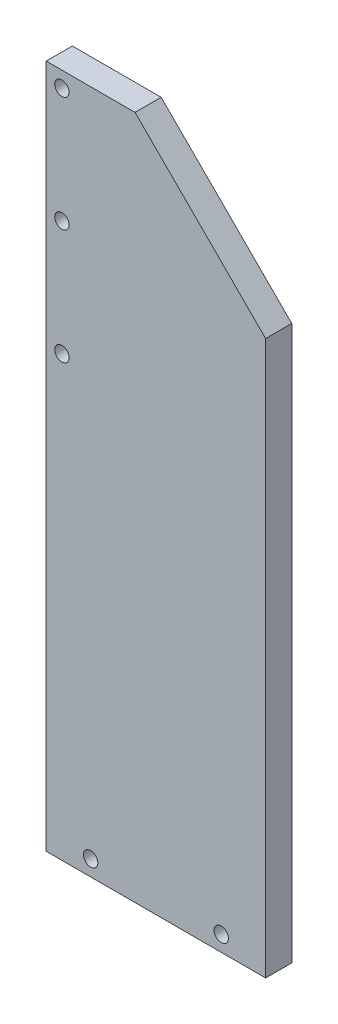
from build123d import *

# Parameters (mm, degrees)
SKETCH1_W                                       = 10
SKETCH1_H                                       = 262
BOSS_EXTRUDE1_DEPTH                             = 42
CBORE_FOR_M5_SOCKET_HEAD_CAP_SCREW1_D           = 5.5
CBORE_FOR_M5_SOCKET_HEAD_CAP_SCREW1_CBORE_D     = 10
CBORE_FOR_M5_SOCKET_HEAD_CAP_SCREW1_CBORE_DEPTH = 5
CBORE_FOR_M5_SOCKET_HEAD_CAP_SCREW2_D           = 5.5
CBORE_FOR_M5_SOCKET_HEAD_CAP_SCREW2_CBORE_D     = 10
CBORE_FOR_M5_SOCKET_HEAD_CAP_SCREW2_CBORE_DEPTH = 5
CHAMFER1_SIZE                                   = 50


with BuildPart() as part:
    # Sketch1 → Boss-Extrude1 (new, symmetric)
    with BuildSketch(Plane(origin=(0, 0, 0), x_dir=(0, 0, -1), z_dir=(1, 0, 0))):
        with Locations((-5, 131)):
            Rectangle(SKETCH1_W, SKETCH1_H)
    extrude(amount=BOSS_EXTRUDE1_DEPTH, both=True)

    # CBORE for M5 Socket Head Cap Screw1 (through all)
    with Locations(Plane(origin=(0, 0, 0), x_dir=(-1, 0, 0), z_dir=(0, 0, -1))):
        with Locations((36, 256), (36, 212), (36, 168)):
            CounterBoreHole(CBORE_FOR_M5_SOCKET_HEAD_CAP_SCREW1_D / 2, CBORE_FOR_M5_SOCKET_HEAD_CAP_SCREW1_CBORE_D / 2, CBORE_FOR_M5_SOCKET_HEAD_CAP_SCREW1_CBORE_DEPTH)

    # CBORE for M5 Socket Head Cap Screw2 (through all)
    with Locations(Plane(origin=(0, 0, 0), x_dir=(-1, 0, 0), z_dir=(0, 0, -1))):
        with Locations((-25, 6), (25, 6)):
            CounterBoreHole(CBORE_FOR_M5_SOCKET_HEAD_CAP_SCREW2_D / 2, CBORE_FOR_M5_SOCKET_HEAD_CAP_SCREW2_CBORE_D / 2, CBORE_FOR_M5_SOCKET_HEAD_CAP_SCREW2_CBORE_DEPTH)

    # Chamfer1
    chamfer1_edges = [part.edges().sort_by_distance(p)[0] for p in [
        (42, 262, 5),
    ]]
    chamfer(chamfer1_edges, length=CHAMFER1_SIZE)


solid = part.part
